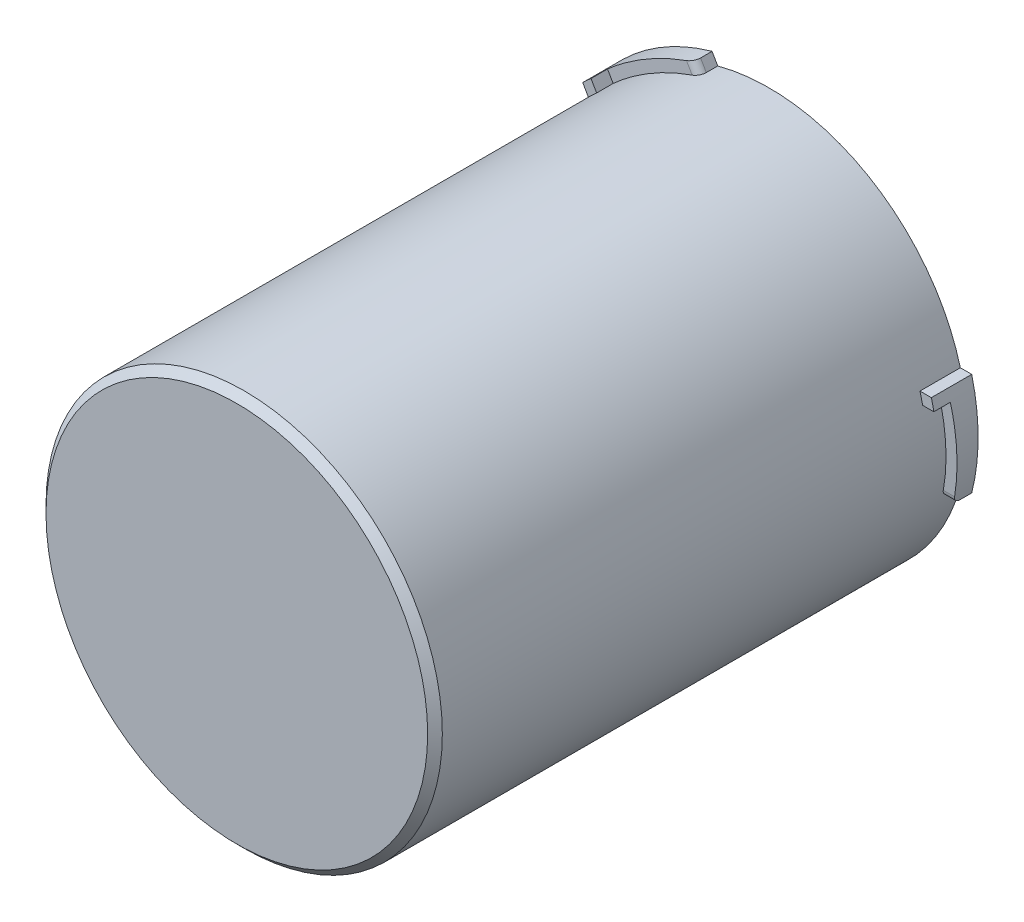
from build123d import *

# Parameters (mm, degrees)
EXTRUDE_1_DEPTH                  = 10
FILLET_1_R                       = 2
PATTERN_CIRCULAR_2_COUNT         = 3
FILLET_1_OF_PATTERN_CIRCULAR_2_R = 2
CUT_EXTRUDE_START                = -15
SKETCH_3_R                       = 51
CUT_EXTRUDE_1_DEPTH              = 15
SKETCH_4_R                       = 62.618720145
SKETCH_4_R_2                     = 57
CUT_EXTRUDE_2_DEPTH              = 15
CHAMFER_1_SIZE                   = 2
FILLET_2_R                       = 5


with BuildPart() as part:
    # Эскиз1 → Повернуть1 (revolve)
    with BuildSketch(Plane(origin=(0, 0, 0), x_dir=(1, 0, 0), z_dir=(0, 1, 0))):
        Polygon((0, 0), (-54, 0), (-54, 145), (-51, 145), (-51, 3), (0, 3), align=None)
    revolve(axis=Axis((0, 0, -3), (0, 0, 1)))

    # Эскиз2 → Бобышка-Вытянуть1 (add)
    with BuildSketch(Plane(origin=(57, 0, 0), x_dir=(0, 0, -1), z_dir=(1, 0, 0))):
        Polygon((145, 14), (145, -14), (140, -14), (138.5, 11), (134, 11), (134, 14), align=None)
    extrude_1 = extrude(amount=-EXTRUDE_1_DEPTH)

    # Скругление1
    fillet_1_edges = [part.edges().sort_by_distance(p)[0] for p in [
        (54.576809621, -14, -140),
    ]]
    fillet(fillet_1_edges, radius=FILLET_1_R)

    # Круговой массив2: Бобышка-Вытянуть1 ×3 about axis
    pattern_circular_2_axis = Axis((0, 0, 0), (0, 0, 1))
    for i in range(1, PATTERN_CIRCULAR_2_COUNT):
        add(extrude_1.rotate(pattern_circular_2_axis, i * 360 / PATTERN_CIRCULAR_2_COUNT))

    # Скругление1 of Круговой массив2
    fillet_1_of_pattern_circular_2_edges = [part.edges().sort_by_distance(p)[0] for p in [
        (-15.164049157, 54.264903589, -140),
        (-39.412760463, -40.264903589, -140),
    ]]
    fillet(fillet_1_of_pattern_circular_2_edges, radius=FILLET_1_OF_PATTERN_CIRCULAR_2_R)

    # Эскиз3 → Вырез-Вытянуть1 (cut)
    with BuildSketch(Plane(origin=(0, 0, -145), x_dir=(-1, 0, 0), z_dir=(0, 0, -1)).offset(CUT_EXTRUDE_START)):
        Circle(SKETCH_3_R)
    extrude(amount=CUT_EXTRUDE_1_DEPTH, mode=Mode.SUBTRACT)

    # Эскиз4 → Вырез-Вытянуть2 (cut)
    with BuildSketch(Plane(origin=(0, 0, -145), x_dir=(-1, 0, 0), z_dir=(0, 0, -1))):
        Circle(SKETCH_4_R)
        Circle(SKETCH_4_R_2, mode=Mode.SUBTRACT)
    extrude(amount=-CUT_EXTRUDE_2_DEPTH, mode=Mode.SUBTRACT)

    # Фаска1
    chamfer_1_edges = [part.edges().sort_by_distance(p)[0] for p in [
        (54, 0, 0),
    ]]
    chamfer(chamfer_1_edges, length=CHAMFER_1_SIZE)

    # Скругление2
    fillet_2_edges = [part.edges().sort_by_distance(p)[0] for p in [
        (51, 0, -3),
    ]]
    fillet(fillet_2_edges, radius=FILLET_2_R)


solid = part.part
